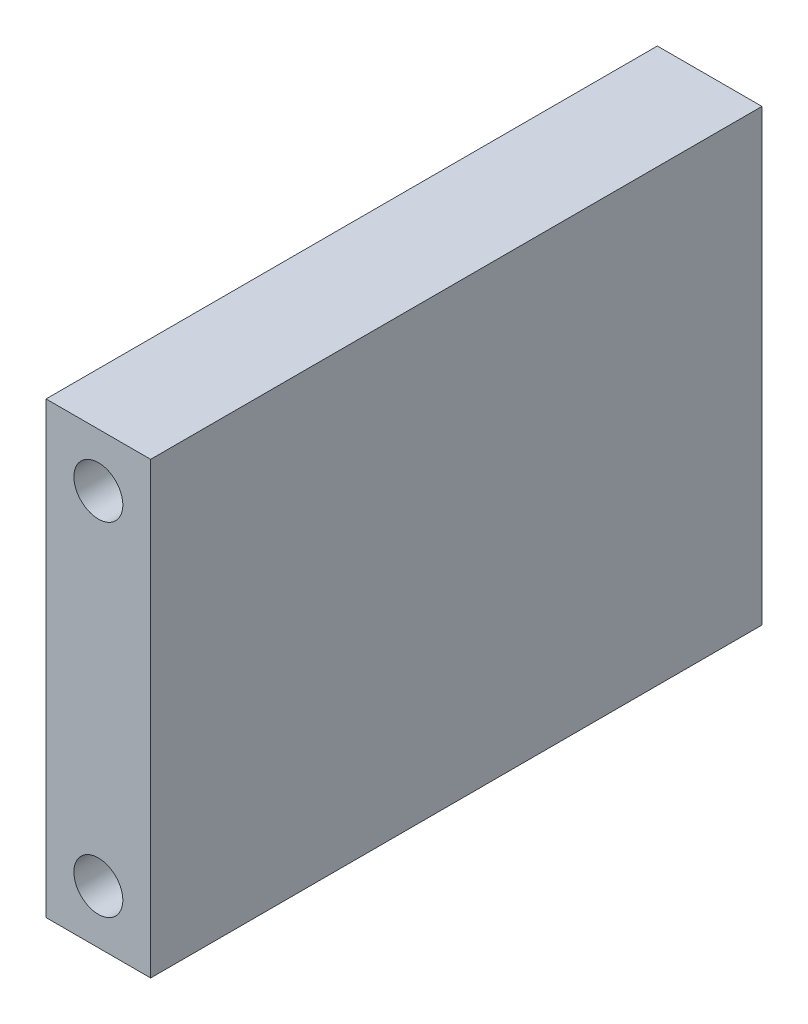
from build123d import *

# Parameters (mm, degrees)
IZIM1_W                     = 17.110844689
IZIM1_H                     = 73.483837376
IZIM1_R                     = 4
Y_KSEKLIK_EKSTR_ZYON1_DEPTH = 100


with BuildPart() as part:
    # Çizim1 → Yükseklik-Ekstrüzyon1 (new body)
    with BuildSketch(Plane.XY):
        with Locations((-0.335867216, 0.489569161)):
            Rectangle(IZIM1_W, IZIM1_H)
        with Locations(Location((-0.335867215, -27.510430839, 0), (0, 0, 180))):
            Circle(IZIM1_R, mode=Mode.SUBTRACT)
        with Locations(Location((-0.335867215, 28.489569161, 0), (0, 0, 180))):
            Circle(IZIM1_R, mode=Mode.SUBTRACT)
    extrude(amount=Y_KSEKLIK_EKSTR_ZYON1_DEPTH)


solid = part.part
